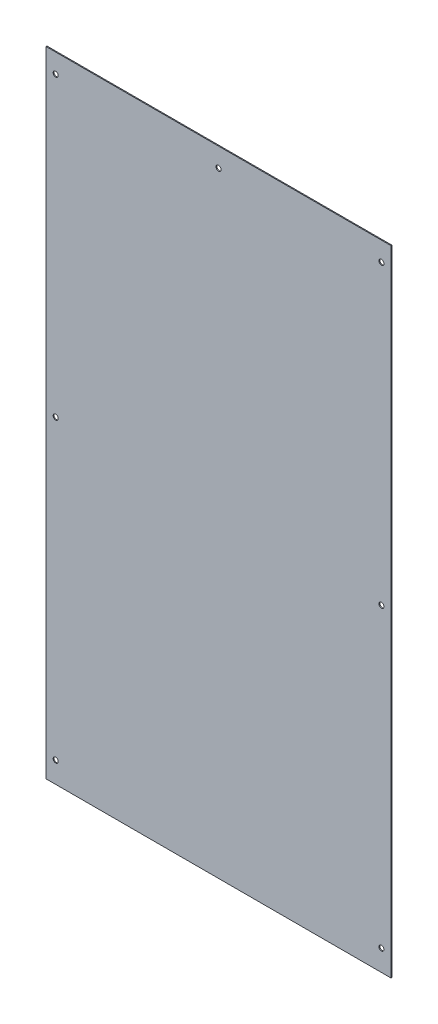
from build123d import *

# Parameters (mm, degrees)
SKETCH1_W               = 457.2
SKETCH1_H               = 840.74
BOSS_EXTRUDE1_DEPTH     = 1.2192
F_1_4_CLEARANCE_HOLE1_D = 6.7564


with BuildPart() as part:
    # Sketch1 → Boss-Extrude1 (new body)
    with BuildSketch(Plane.XY):
        with Locations((228.6, 420.37)):
            Rectangle(SKETCH1_W, SKETCH1_H)
    extrude(amount=BOSS_EXTRUDE1_DEPTH)

    # 1/4 Clearance Hole1 (through all)
    with Locations(Plane.XY.offset(1.2192)):
        with Locations((12.7, 815.34), (228.6, 815.34), (444.5, 815.34), (444.5, 421.64), (12.7, 421.64), (12.7, 27.94), (444.5, 27.94)):
            Hole(F_1_4_CLEARANCE_HOLE1_D / 2)


solid = part.part
